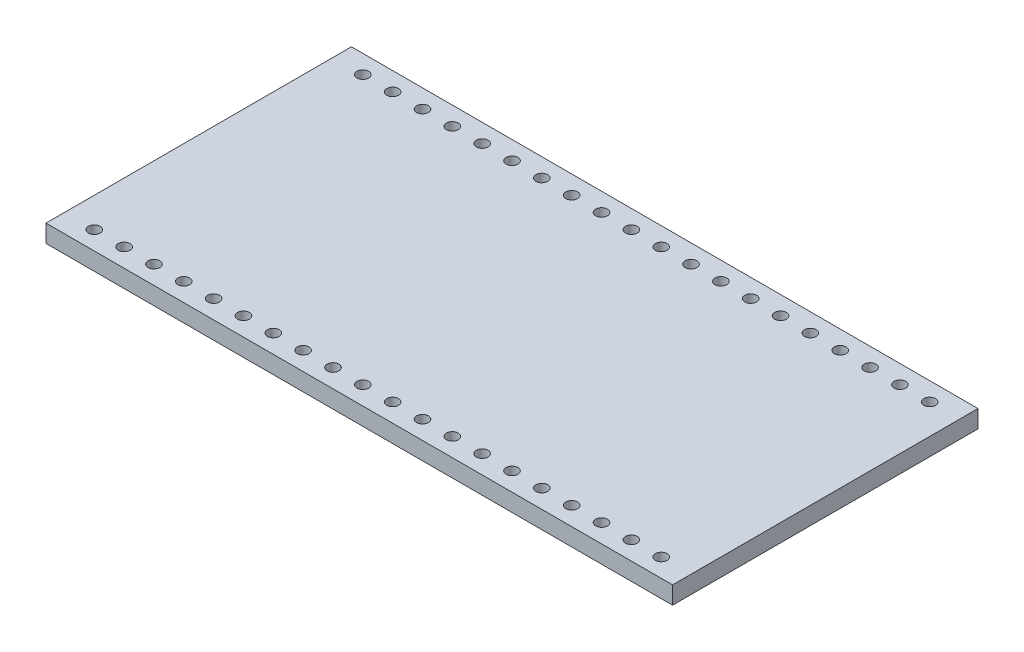
from build123d import *

# Parameters (mm, degrees)
SKETCH1_W           = 53.34
SKETCH1_H           = 26
BOSS_EXTRUDE1_DEPTH = 1.5
CUT_EXTRUDE1_REACH  = 61.358
SKETCH2_R           = 0.5
LPATTERN1_COUNT     = 20
LPATTERN1_PITCH     = 2.54


with BuildPart() as part:
    # Sketch1 → Boss-Extrude1 (new body)
    with BuildSketch(Plane(origin=(0, 0, 0), x_dir=(1, 0, 0), z_dir=(0, 1, 0))):
        with Locations((26.67, 13)):
            Rectangle(SKETCH1_W, SKETCH1_H)
    extrude(amount=BOSS_EXTRUDE1_DEPTH)

    # Sketch2 → Cut-Extrude1 (cut, up to next)
    with BuildSketch(Plane(origin=(0, 1.5, 0), x_dir=(1, 0, 0), z_dir=(0, 1, 0)), mode=Mode.PRIVATE) as cut_extrude1_sk1:
        with Locations(Location((2.54, 1.57, 0), (0, 0, 270))):
            Circle(SKETCH2_R)
    cut_extrude1_tool1 = extrude(cut_extrude1_sk1.sketch, amount=-CUT_EXTRUDE1_REACH, mode=Mode.PRIVATE) & part.part
    # Sketch2 → Cut-Extrude1 (cut, up to next)
    with BuildSketch(Plane(origin=(0, 1.5, 0), x_dir=(1, 0, 0), z_dir=(0, 1, 0)), mode=Mode.PRIVATE) as cut_extrude1_sk2:
        with Locations(Location((2.54, 24.43, 0), (0, 0, 270))):
            Circle(SKETCH2_R)
    cut_extrude1_tool2 = extrude(cut_extrude1_sk2.sketch, amount=-CUT_EXTRUDE1_REACH, mode=Mode.PRIVATE) & part.part
    cut_extrude1_1 = cut_extrude1_tool1.solids().sort_by_distance((2.54, 1.5, -1.57))[0]
    add(cut_extrude1_1, mode=Mode.SUBTRACT)
    cut_extrude1_2 = cut_extrude1_tool2.solids().sort_by_distance((2.54, 1.5, -24.43))[0]
    add(cut_extrude1_2, mode=Mode.SUBTRACT)
    cut_extrude1 = cut_extrude1_1 + cut_extrude1_2  # Cut-Extrude1 as one shape, for the pattern or mirror that repeats it

    # LPattern1: Cut-Extrude1 ×20
    with Locations(*[(i * LPATTERN1_PITCH, 0, 0) for i in range(1, LPATTERN1_COUNT)]):
        add(cut_extrude1, mode=Mode.SUBTRACT)


solid = part.part
